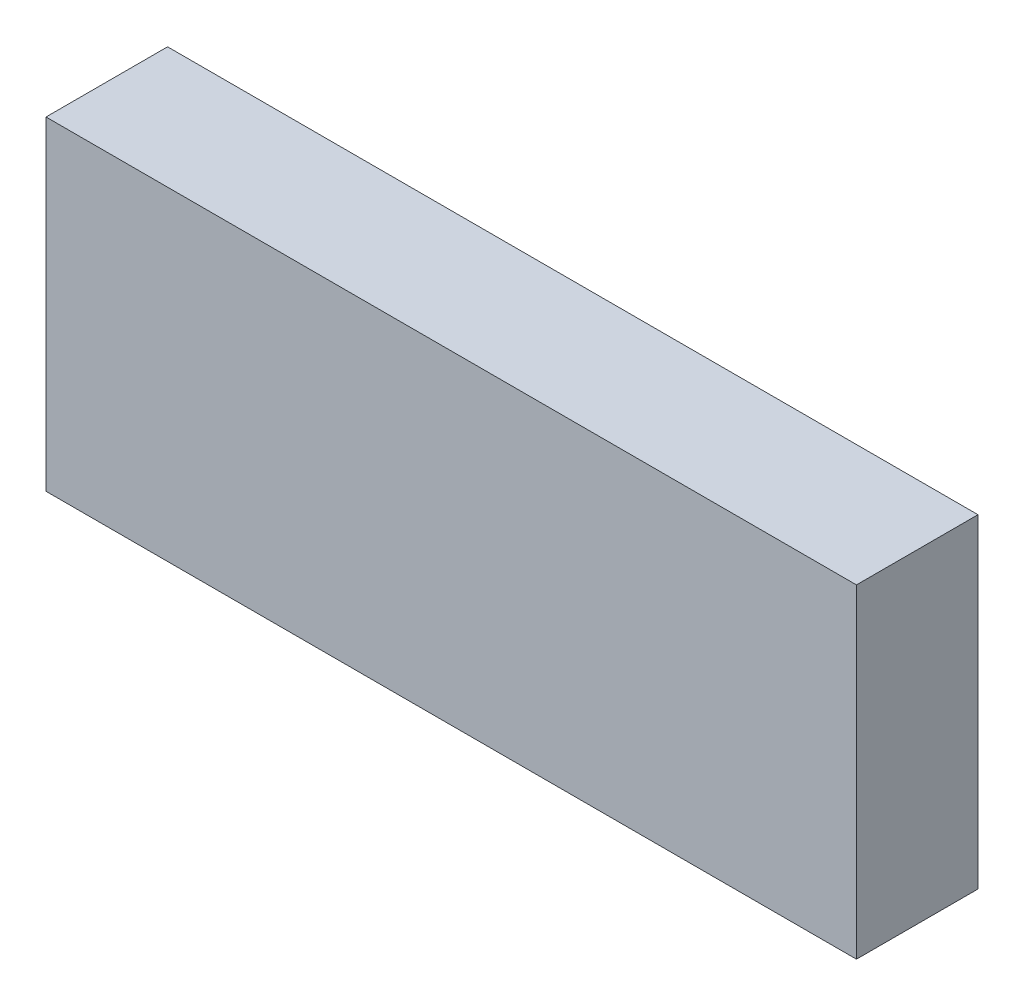
from build123d import *

# Parameters (mm, degrees)
SKETCH_1_W      = 80
SKETCH_1_H      = 32
EXTRUDE_1_DEPTH = 12


with BuildPart() as part:
    # 草图1 → 凸台-拉伸1 (new body)
    with BuildSketch(Plane.XY):
        with Locations((0, 16)):
            Rectangle(SKETCH_1_W, SKETCH_1_H)
    extrude(amount=EXTRUDE_1_DEPTH)


solid = part.part
